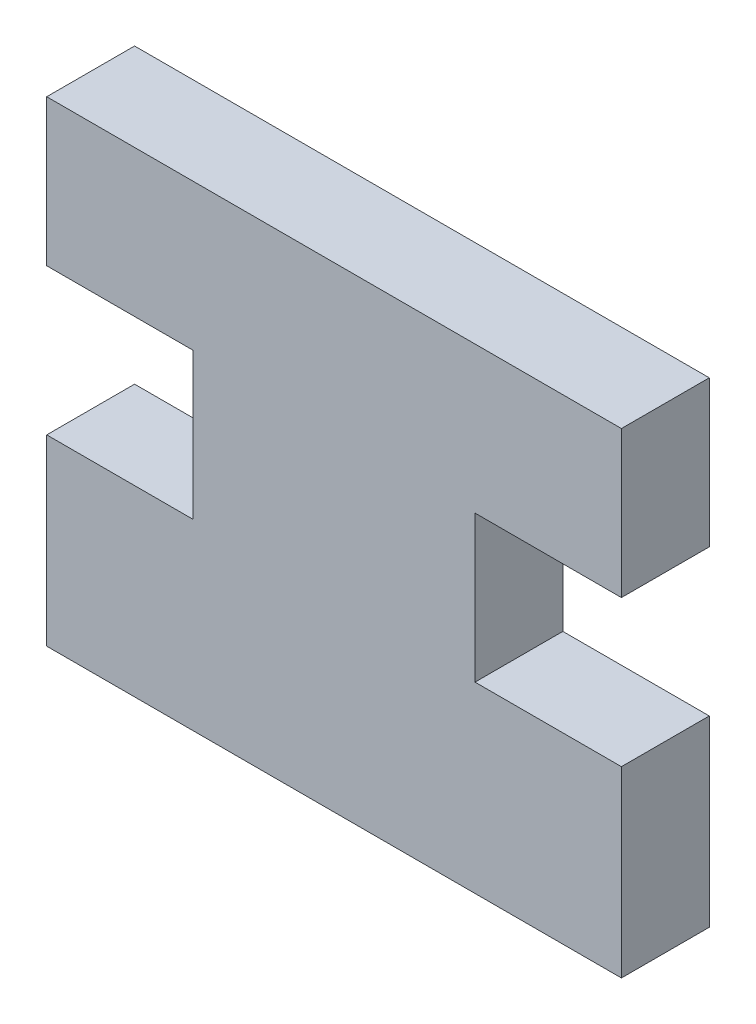
from build123d import *

# Parameters (mm, degrees)
BOSS_EXTRUDE1_DEPTH = 0.24


with BuildPart() as part:
    # Sketch1 → Boss-Extrude1 (new body)
    with BuildSketch(Plane.XY):
        Polygon((0, 0), (0, 0.5), (0.4, 0.5), (0.4, 0.9), (0, 0.9), (0, 1.3), (1.57, 1.3), (1.57, 0.9), (1.17, 0.9), (1.17, 0.5), (1.57, 0.5), (1.57, 0), align=None)
    extrude(amount=BOSS_EXTRUDE1_DEPTH)


solid = part.part
